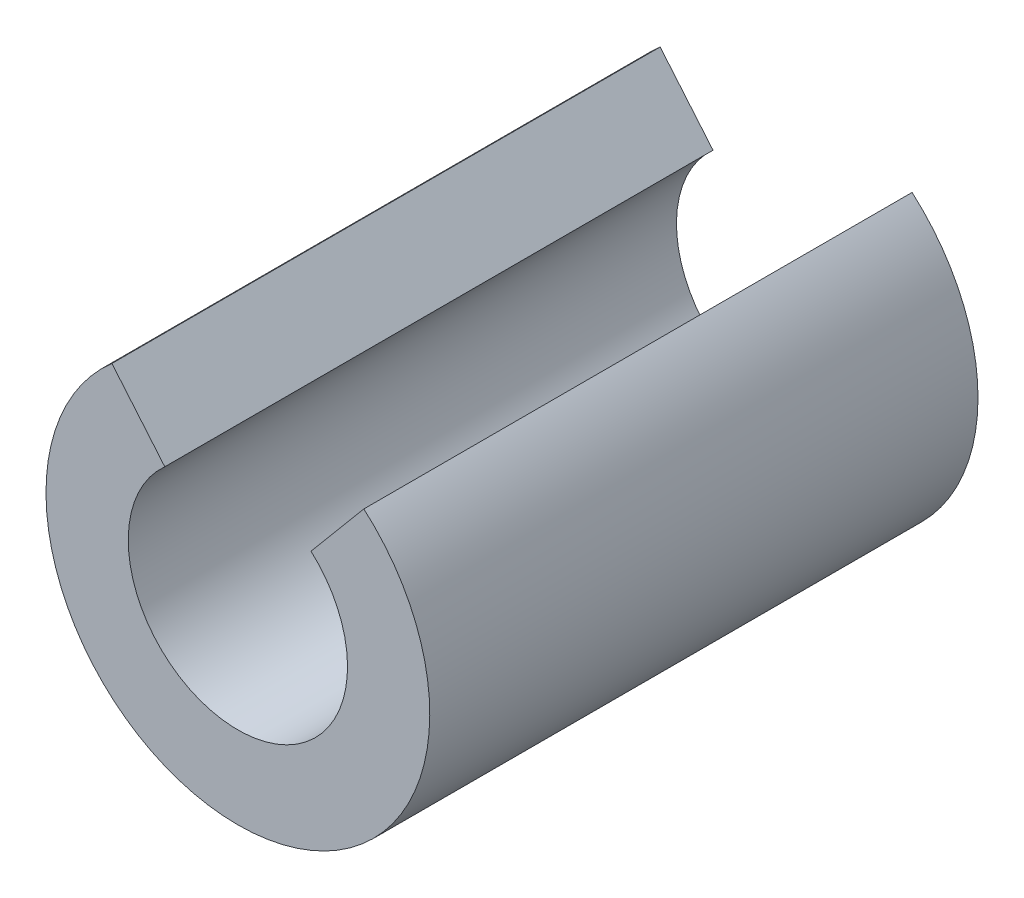
from build123d import *

# Parameters (mm, degrees)
EXTRUDE_1_DEPTH = 15


with BuildPart() as part:
    # 草图1 → 凸台-拉伸1 (new, symmetric)
    with BuildSketch(Plane.XY):
        with BuildLine():
            Line((-6.8933694, 7.920319332), (-4, 4.472135955))
            ThreePointArc((-4, 4.472135955), (0, -6), (4, 4.472135955))
            Line((4, 4.472135955), (6.8933694, 7.920319332))
            ThreePointArc((6.8933694, 7.920319332), (0, -10.5), (-6.8933694, 7.920319332))
        make_face()
    extrude(amount=EXTRUDE_1_DEPTH, both=True)


solid = part.part
